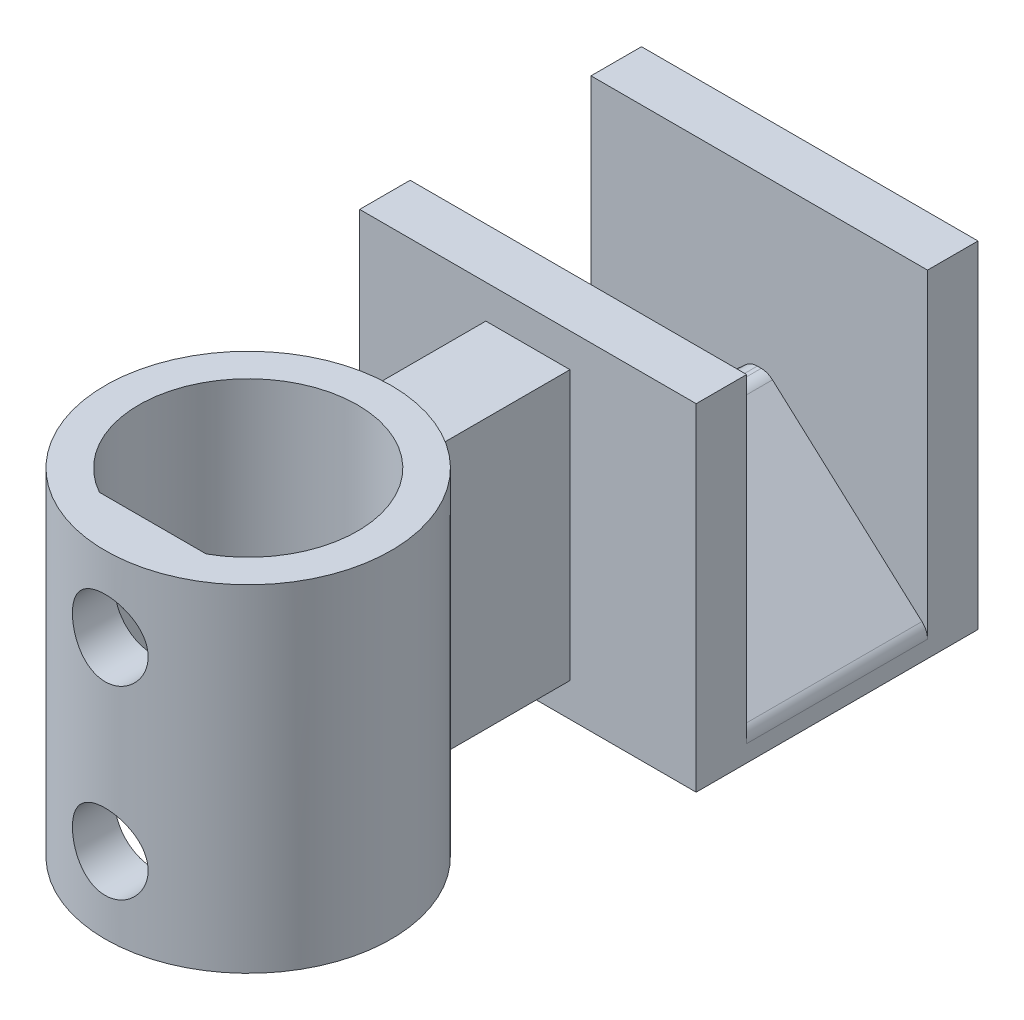
from build123d import *

# Parameters (mm, degrees)
SKETCH2_W                       = 20
SKETCH2_H                       = 10
BOSS_EXTRUDE1_DEPTH             = 5.375
CHAMFER1_SIZE                   = 9.5
CHAMFER1_SIZE2                  = 8.553838421
FILLET3_R                       = 1
SKETCH3_W                       = 20
SKETCH3_H                       = 20
BOSS_EXTRUDE2_DEPTH             = 3
BOSS_EXTRUDE3_REACH             = 21.878
SKETCH6_R                       = 8.5
BOSS_EXTRUDE3_DIRECTION_2_REACH = 21.878
BOSS_EXTRUDE4_REACH             = 32.924
BOSS_EXTRUDE4_END_RADIUS        = 8.5
SKETCH5_W                       = 5
SKETCH5_H                       = 16
CUT_EXTRUDE1_REACH              = 35.618
CUT_EXTRUDE1_END_RADIUS         = 8.5
SKETCH7_R                       = 2.25


with BuildPart() as part:
    # Sketch2 → Boss-Extrude1 (new, symmetric)
    with BuildSketch(Plane.XY):
        Rectangle(SKETCH2_W, SKETCH2_H)
    extrude(amount=BOSS_EXTRUDE1_DEPTH, both=True)

    # Chamfer1
    chamfer1_edges = [part.edges().sort_by_distance(p)[0] for p in [
        (-10, 5, 0),
        (10, 5, 0),
    ]]
    chamfer1_side = [part.faces().sort_by_distance(p)[0] for p in [
        (0, 5, 0),
    ]]
    chamfer(chamfer1_edges, length=CHAMFER1_SIZE, length2=CHAMFER1_SIZE2, reference=chamfer1_side[0])

    # Fillet3
    fillet3_edges = [part.edges().sort_by_distance(p)[0] for p in [
        (-0.5, 5, 0),
        (0.5, 5, 0),
        (10, -3.553838421, 0),
        (-10, -3.553838421, 0),
    ]]
    fillet(fillet3_edges, radius=FILLET3_R)

    # Sketch3 → Boss-Extrude2 (add)
    with BuildSketch(Plane.XY.offset(5.375)):
        with Locations((0, 5)):
            Rectangle(SKETCH3_W, SKETCH3_H)
    boss_extrude2 = extrude(amount=BOSS_EXTRUDE2_DEPTH)

    # Mirror1: Boss-Extrude2 across plane
    add(boss_extrude2.mirror(Plane.XY))


with BuildPart() as body_2:

    # Boss-Extrude3: up to this face of the body (flat: up to its plane)
    boss_extrude3_end = Plane(part.part.faces().sort_by_distance((0, 15, 6.875))[0])
    # Sketch6 → Boss-Extrude3 (new, up to the picked face)
    with BuildSketch(Plane(origin=(0, 0, 0), x_dir=(1, 0, 0), z_dir=(0, 1, 0)), mode=Mode.PRIVATE) as boss_extrude3_sk1:
        with Locations(Location((0, -25, 0), (0, 0, 90))):
            Circle(SKETCH6_R)
        with BuildLine():
            Line((-3.175, -30.671805268), (3.175, -30.671805268))
            ThreePointArc((3.175, -30.671805268), (0, -18.5), (-3.175, -30.671805268))
        make_face(mode=Mode.SUBTRACT)
    boss_extrude3_tool1 = split(extrude(boss_extrude3_sk1.sketch, amount=BOSS_EXTRUDE3_REACH, mode=Mode.PRIVATE), bisect_by=boss_extrude3_end, keep=Keep.BOTH, mode=Mode.PRIVATE)
    add(boss_extrude3_tool1.solids().sort_by(Axis((0, 0, 33.259584), (0, 1, 0)))[0])


    # Boss-Extrude3 direction 2: up to this face of the body (flat: up to its plane)
    boss_extrude3_direction_2_end = Plane(part.part.faces().sort_by_distance((0, -5, 0))[0])
    # Sketch6 → Boss-Extrude3 direction 2 (add, up to the picked face)
    with BuildSketch(Plane(origin=(0, 0, 0), x_dir=(1, 0, 0), z_dir=(0, 1, 0)), mode=Mode.PRIVATE) as boss_extrude3_direction_2_sk1:
        with Locations(Location((0, -25, 0), (0, 0, 90))):
            Circle(SKETCH6_R)
        with BuildLine():
            Line((-3.175, -30.671805268), (3.175, -30.671805268))
            ThreePointArc((3.175, -30.671805268), (0, -18.5), (-3.175, -30.671805268))
        make_face(mode=Mode.SUBTRACT)
    boss_extrude3_direction_2_tool1 = split(extrude(boss_extrude3_direction_2_sk1.sketch, amount=-BOSS_EXTRUDE3_DIRECTION_2_REACH, mode=Mode.PRIVATE), bisect_by=boss_extrude3_direction_2_end, keep=Keep.BOTH, mode=Mode.PRIVATE)
    add(boss_extrude3_direction_2_tool1.solids().sort_by(Axis((0, 0, 33.259584), (0, -1, 0)))[0])


with BuildPart() as part_1:
    add(part.part)

    add(body_2.part)  # Boss-Extrude4 merges body 2
    # Boss-Extrude4: up to this cylinder (the profile starts outside it)
    boss_extrude4_end = Plane(origin=(0, 5, 25), z_dir=(0, -1, 0)) * Cylinder(BOSS_EXTRUDE4_END_RADIUS, 83.848, mode=Mode.PRIVATE)
    # Sketch5 → Boss-Extrude4 (add, up to the surface)
    with BuildSketch(Plane.XY.offset(8.375), mode=Mode.PRIVATE) as boss_extrude4_sk1:
        with Locations((0, 5)):
            Rectangle(SKETCH5_W, SKETCH5_H)
    boss_extrude4_tool1 = extrude(boss_extrude4_sk1.sketch, amount=BOSS_EXTRUDE4_REACH, mode=Mode.PRIVATE) - boss_extrude4_end
    add(boss_extrude4_tool1.solids().sort_by_distance((0, 5, 8.375))[0])

    # Cut-Extrude1: up to this cylinder (the profile starts inside it)
    cut_extrude1_end = Plane(origin=(0, 5, 25), z_dir=(0, -1, 0)) * Cylinder(CUT_EXTRUDE1_END_RADIUS, 100.236, mode=Mode.PRIVATE)
    # Sketch7 → Cut-Extrude1 (cut, up to the surface)
    with BuildSketch(Plane.XY.offset(20), mode=Mode.PRIVATE) as cut_extrude1_sk1:
        with Locations(Location((0, 10.5, 0), (0, 0, 180))):
            Circle(SKETCH7_R)
    cut_extrude1_tool1 = extrude(cut_extrude1_sk1.sketch, amount=CUT_EXTRUDE1_REACH, mode=Mode.PRIVATE) & cut_extrude1_end
    add(cut_extrude1_tool1.solids().sort_by_distance((0, 10.5, 20))[0], mode=Mode.SUBTRACT)
    # Sketch7 → Cut-Extrude1 (cut, up to the surface)
    with BuildSketch(Plane.XY.offset(20), mode=Mode.PRIVATE) as cut_extrude1_sk2:
        with Locations(Location((0, -0.5, 0), (0, 0, 180))):
            Circle(SKETCH7_R)
    cut_extrude1_tool2 = extrude(cut_extrude1_sk2.sketch, amount=CUT_EXTRUDE1_REACH, mode=Mode.PRIVATE) & cut_extrude1_end
    add(cut_extrude1_tool2.solids().sort_by_distance((0, -0.5, 20))[0], mode=Mode.SUBTRACT)


solid = part_1.part
